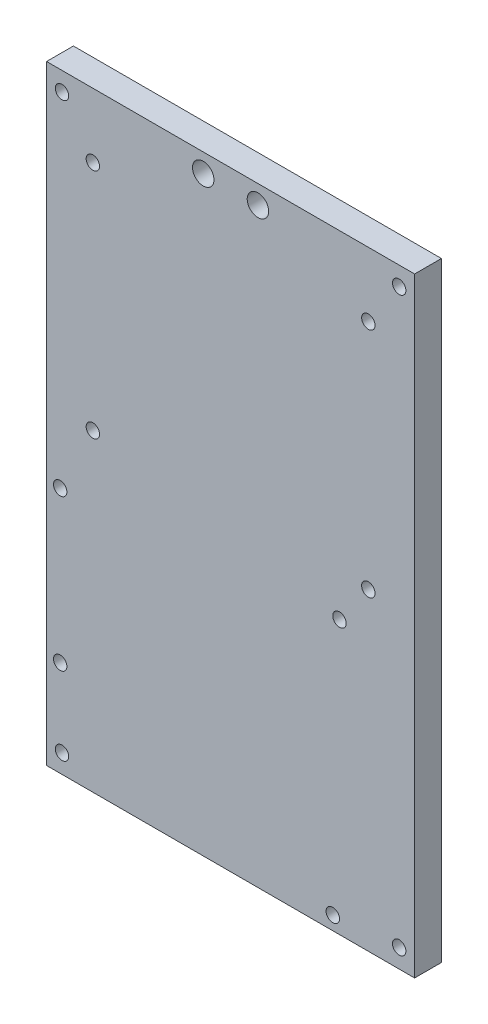
from build123d import *

# Parameters (mm, degrees)
SKETCH1_W                        = 68.600000001
SKETCH1_H                        = 113.65
BRACKETBASE_DEPTH                = 5
ARDUINOMOUNTINGHOLES_DEPTH       = 22
ARDUINOMOUNTINGHOLES_DEPTH_BACK  = 120.777809299
ARDUINOMOUNTINGHOLESSKETCH_R     = 1.25
F_9VBATTERYMOUNTINGHOLESSKETCH_R = 1.25
F_9VBATTERYMOUNTINGHOLES_DEPTH   = 20
LEGBRACKETMOUNTINGHOLESSKETCH_R  = 2
LEGBRACKETMOUNTINGHOLES_DEPTH    = 13
BACKSIDEMOUNTINGHOLESSKETCH_R    = 1.25
BACKSIDEMOUNTINGHOLES_DEPTH      = 24


with BuildPart() as part:
    # Sketch1 → bracketBase (new body)
    with BuildSketch(Plane.XY):
        with Locations((34.3, 41.235000001)):
            Rectangle(SKETCH1_W, SKETCH1_H)
    extrude(amount=BRACKETBASE_DEPTH)

    # arduinoMountingHolesSketch → arduinoMountingHoles (cut, two sides: drawn at the far end of the back side and taken through both)
    with BuildSketch(Plane.XY.offset(-ARDUINOMOUNTINGHOLES_DEPTH_BACK)):
        with Locations((2.54, 2.280000001)):
            Circle(ARDUINOMOUNTINGHOLESSKETCH_R)
        with Locations((2.54, 30.450000001)):
            Circle(ARDUINOMOUNTINGHOLESSKETCH_R)
        with Locations((54.600000001, 35.270000001)):
            Circle(ARDUINOMOUNTINGHOLESSKETCH_R)
        with Locations((53.350000001, -13.049999999)):
            Circle(ARDUINOMOUNTINGHOLESSKETCH_R)
    extrude(amount=ARDUINOMOUNTINGHOLES_DEPTH + ARDUINOMOUNTINGHOLES_DEPTH_BACK, mode=Mode.SUBTRACT)

    # 9VbatteryMountingHolesSketch → 9VbatteryMountingHoles (cut)
    with BuildSketch(Plane.XY):
        with Locations((8.625000001, 86.060000001)):
            Circle(F_9VBATTERYMOUNTINGHOLESSKETCH_R)
        with Locations(Location((59.975000001, 86.060000001, 0), (0, 0, 180))):
            Circle(F_9VBATTERYMOUNTINGHOLESSKETCH_R)
        with Locations(Location((8.625000001, 42.810000001, 0), (0, 0, 180))):
            Circle(F_9VBATTERYMOUNTINGHOLESSKETCH_R)
        with Locations((59.975000001, 42.810000001)):
            Circle(F_9VBATTERYMOUNTINGHOLESSKETCH_R)
    extrude(amount=F_9VBATTERYMOUNTINGHOLES_DEPTH, mode=Mode.SUBTRACT)

    # legBracketMountingHolesSketch → legBracketMountingHoles (cut)
    with BuildSketch(Plane.XY):
        with Locations((29.202551646, 94.560000001)):
            Circle(LEGBRACKETMOUNTINGHOLESSKETCH_R)
        with Locations(Location((39.397448356, 94.560000001, 0), (0, 0, 180))):
            Circle(LEGBRACKETMOUNTINGHOLESSKETCH_R)
    extrude(amount=LEGBRACKETMOUNTINGHOLES_DEPTH, mode=Mode.SUBTRACT)

    # backsideMountingHolesSketch → backsideMountingHoles (cut)
    with BuildSketch(Plane.XY):
        with Locations((2.875000001, 94.560000001)):
            Circle(BACKSIDEMOUNTINGHOLESSKETCH_R)
        with Locations(Location((65.725000001, 94.560000001, 0), (0, 0, 180))):
            Circle(BACKSIDEMOUNTINGHOLESSKETCH_R)
        with Locations((65.725000001, -12.089999999)):
            Circle(BACKSIDEMOUNTINGHOLESSKETCH_R)
        with Locations(Location((2.875000001, -12.089999999, 0), (0, 0, 180))):
            Circle(BACKSIDEMOUNTINGHOLESSKETCH_R)
    extrude(amount=BACKSIDEMOUNTINGHOLES_DEPTH, mode=Mode.SUBTRACT)


solid = part.part
